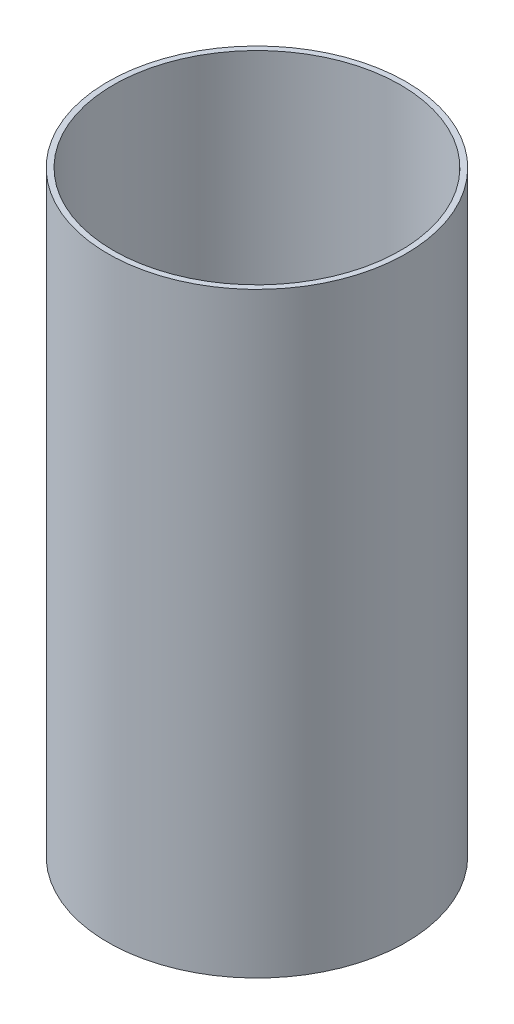
from build123d import *

# Parameters (mm, degrees)
COUPLER_PROFILE_R   = 76.1746
COUPLER_PROFILE_R_2 = 73.3425
COUPLER_BODY_DEPTH  = 304.8


with BuildPart() as part:
    # Coupler Profile → Coupler Body (new body)
    with BuildSketch(Plane(origin=(0, 0, 0), x_dir=(1, 0, 0), z_dir=(0, 1, 0))):
        with Locations(Location((0, 0, 0), (0, 0, 90))):
            Circle(COUPLER_PROFILE_R)
        with Locations(Location((0, 0, 0), (0, 0, 90))):
            Circle(COUPLER_PROFILE_R_2, mode=Mode.SUBTRACT)
    extrude(amount=COUPLER_BODY_DEPTH)


solid = part.part
